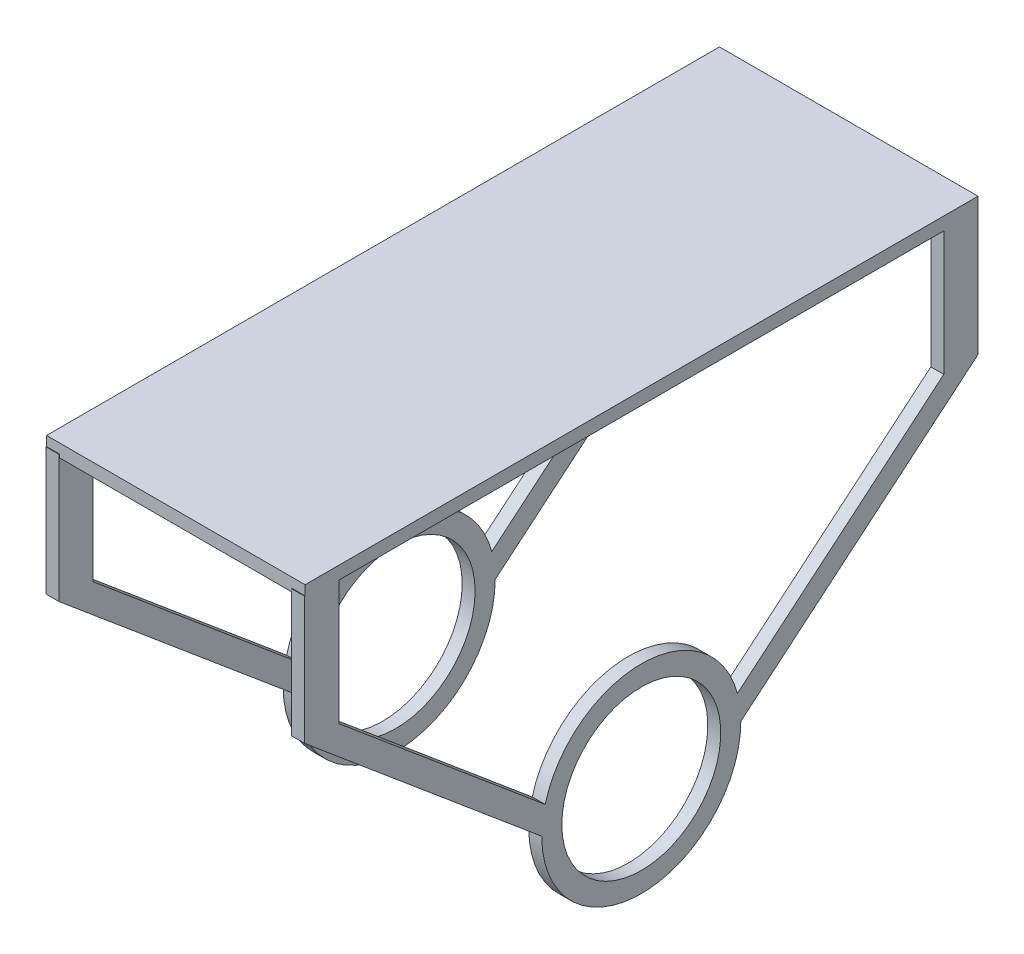
from build123d import *

# Parameters (mm, degrees)
SKETCH1_R           = 77.003067154
SKETCH1_R_2         = 61.468535345
BOSS_EXTRUDE1_DEPTH = 10
BOSS_EXTRUDE2_DEPTH = 10
SKETCH3_W           = 26.477717066
SKETCH3_H           = 98.615222644
BOSS_EXTRUDE3_DEPTH = 10
SKETCH5_R           = 77.003067154
SKETCH5_R_2         = 61.468535345
BOSS_EXTRUDE4_DEPTH = 10
BOSS_EXTRUDE5_START = 10
BOSS_EXTRUDE5_DEPTH = 10
SKETCH8_W           = 26.477717066
SKETCH8_H           = 98.615222644
BOSS_EXTRUDE6_DEPTH = 10
SKETCH9_W           = 200
SKETCH9_H           = 520.453768192
BOSS_EXTRUDE7_DEPTH = 10


with BuildPart() as part:
    # Sketch1 → Boss-Extrude1 (new body)
    with BuildSketch(Plane(origin=(0, 0, 0), x_dir=(0, 0, -1), z_dir=(1, 0, 0))):
        Circle(SKETCH1_R)
        Circle(SKETCH1_R_2, mode=Mode.SUBTRACT)
    extrude(amount=BOSS_EXTRUDE1_DEPTH)

    # Sketch2 → Boss-Extrude2 (add)
    with BuildSketch(Plane(origin=(0, 0, 0), x_dir=(0, 0, -1), z_dir=(1, 0, 0))):
        with BuildLine():
            Line((-74.36042194, 20), (-233.957245684, 153.917635941))
            Line((-233.957245684, 153.917635941), (-260.43496275, 153.917635941))
            Line((-260.43496275, 153.917635941), (-77.003067154, 0))
            ThreePointArc((-77.003067154, 0), (-76.339547141, 10.086916944), (-74.36042194, 20))
        make_face()
    boss_extrude2 = extrude(amount=BOSS_EXTRUDE2_DEPTH)

    # Sketch3 → Boss-Extrude3 (add)
    with BuildSketch(Plane(origin=(0, 0, 0), x_dir=(0, 0, -1), z_dir=(1, 0, 0))):
        with Locations((-247.196104217, 203.225247263)):
            Rectangle(SKETCH3_W, SKETCH3_H)
    boss_extrude3 = extrude(amount=BOSS_EXTRUDE3_DEPTH)

    # Mirror2: Boss-Extrude2, Boss-Extrude3 across plane
    add(boss_extrude2.mirror(Plane.XY))
    add(boss_extrude3.mirror(Plane.XY))



with BuildPart() as body_2:
    # Sketch5 → Boss-Extrude4 (new body)
    with BuildSketch(Plane.ZY.offset(-200)):
        Circle(SKETCH5_R)
        with Locations(Location((0, 0, 0), (0, 0, 180))):
            Circle(SKETCH5_R_2, mode=Mode.SUBTRACT)
    extrude(amount=BOSS_EXTRUDE4_DEPTH)

    # Sketch7 → Boss-Extrude5 (add)
    with BuildSketch(Plane.ZY.offset(-200).offset(BOSS_EXTRUDE5_START)):
        with BuildLine():
            Line((-74.36042194, 20), (-233.957245684, 153.917635941))
            Line((-233.957245684, 153.917635941), (-260.43496275, 153.917635941))
            Line((-260.43496275, 153.917635941), (-77.003067154, 0))
            ThreePointArc((-77.003067154, 0), (-76.339547141, 10.086916944), (-74.36042194, 20))
        make_face()
    boss_extrude5 = extrude(amount=-BOSS_EXTRUDE5_DEPTH)

    # Sketch8 → Boss-Extrude6 (add)
    with BuildSketch(Plane.ZY.offset(-200)):
        with Locations((-247.196104217, 203.225247263)):
            Rectangle(SKETCH8_W, SKETCH8_H)
    boss_extrude6 = extrude(amount=BOSS_EXTRUDE6_DEPTH)

    # Mirror5: Boss-Extrude5 across plane
    add(boss_extrude5.mirror(Plane.XY))

    # Mirror6: Boss-Extrude6 across plane
    add(boss_extrude6.mirror(Plane.XY))


with BuildPart() as part_1:
    add(part.part)

    add(body_2.part)  # Boss-Extrude7 merges body 2
    # Sketch9 → Boss-Extrude7 (add)
    with BuildSketch(Plane(origin=(0, 250, 0), x_dir=(1, 0, 0), z_dir=(0, 1, 0))):
        with Locations((100, 0.208078654)):
            Rectangle(SKETCH9_W, SKETCH9_H)
    extrude(amount=BOSS_EXTRUDE7_DEPTH)


solid = part_1.part
